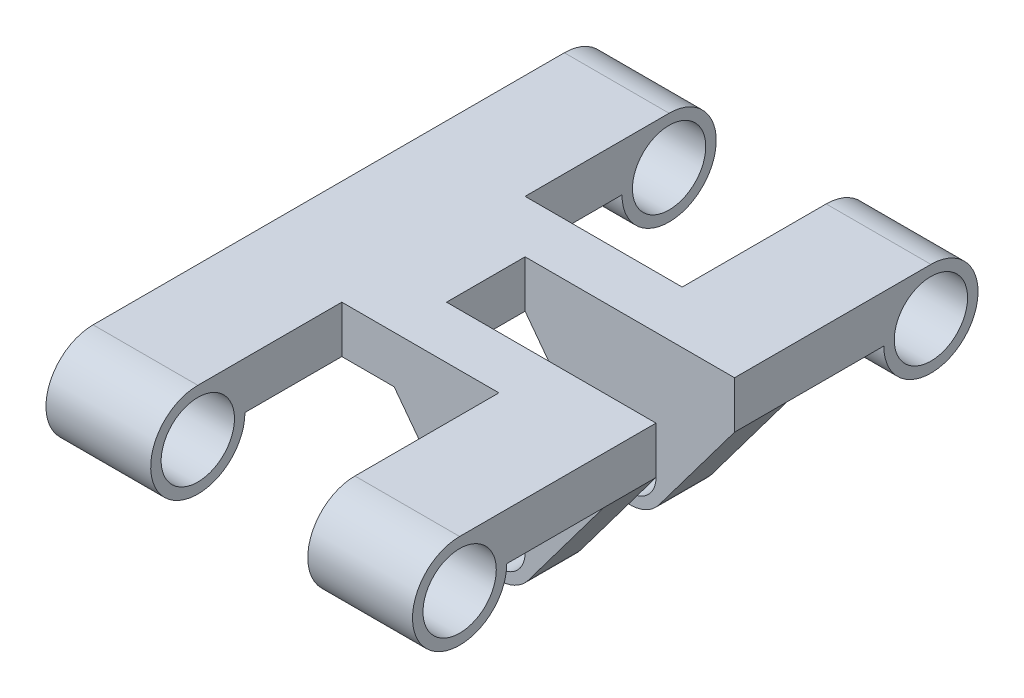
from build123d import *

# Parameters (mm, degrees)
SKETCH1_R           = 9
SKETCH1_R_2         = 7
BOSS_EXTRUDE1_DEPTH = 20
BOSS_EXTRUDE2_DEPTH = 9
SKETCH3_R           = 9
SKETCH3_R_2         = 7
BOSS_EXTRUDE4_DEPTH = 20
SKETCH6_R           = 5
BOSS_EXTRUDE7_DEPTH = 10
BOSS_EXTRUDE8_START = 25
SKETCH6_3_R         = 5
BOSS_EXTRUDE8_DEPTH = 10


with BuildPart() as part:
    # Sketch1 → Boss-Extrude1 (new body)
    # profile 1 of 3: a face of its own
    with BuildSketch(Plane(origin=(0, 0, 0), x_dir=(0, 0, -1), z_dir=(1, 0, 0))):
        with BuildLine():
            Line((90, 9), (0, 9))
            ThreePointArc((0, 9), (6.363961031, 6.363961031), (9, 0))
            Line((9, 0), (81, 0))
            ThreePointArc((81, 0), (83.636038969, 6.363961031), (90, 9))
        make_face()
    # profile 2 of 3: a face of its own
    with BuildSketch(Plane(origin=(0, 0, 0), x_dir=(0, 0, -1), z_dir=(1, 0, 0))):
        Circle(SKETCH1_R)
        Circle(SKETCH1_R_2, mode=Mode.SUBTRACT)
    # profile 3 of 3: a face of its own
    with BuildSketch(Plane(origin=(0, 0, 0), x_dir=(0, 0, -1), z_dir=(1, 0, 0))):
        with Locations((90, 0)):
            Circle(SKETCH1_R)
        with Locations((90, 0)):
            Circle(SKETCH1_R_2, mode=Mode.SUBTRACT)
    extrude(amount=-BOSS_EXTRUDE1_DEPTH)

    # Sketch2 → Boss-Extrude2 (add)
    with BuildSketch(Plane(origin=(0, 9, 0), x_dir=(1, 0, 0), z_dir=(0, 1, 0))):
        Polygon((0, 62.5), (50, 62.5), (50, 52.5), (10, 52.5), (10, 37.5), (50, 37.5), (50, 27.5), (0, 27.5), align=None)
    extrude(amount=-BOSS_EXTRUDE2_DEPTH)

    # Sketch3 → Boss-Extrude4 (add)
    # profile 1 of 4: a face of its own
    with BuildSketch(Plane(origin=(50, 0, 0), x_dir=(0, 0, -1), z_dir=(1, 0, 0))):
        Circle(SKETCH3_R)
        Circle(SKETCH3_R_2, mode=Mode.SUBTRACT)
    # profile 2 of 4: a face of its own
    with BuildSketch(Plane(origin=(50, 0, 0), x_dir=(0, 0, -1), z_dir=(1, 0, 0))):
        with BuildLine():
            Line((27.5, 9), (0, 9))
            ThreePointArc((0, 9), (6.363961031, 6.363961031), (9, 0))
            Line((9, 0), (27.5, 0))
            Line((27.5, 0), (27.5, 9))
        make_face()
    # profile 3 of 4: a face of its own
    with BuildSketch(Plane(origin=(50, 0, 0), x_dir=(0, 0, -1), z_dir=(1, 0, 0))):
        with BuildLine():
            Line((90, 9), (52.5, 9))
            Line((52.5, 9), (52.5, 0))
            Line((52.5, 0), (81, 0))
            ThreePointArc((81, 0), (83.636038969, 6.363961031), (90, 9))
        make_face()
    # profile 4 of 4: a face of its own
    with BuildSketch(Plane(origin=(50, 0, 0), x_dir=(0, 0, -1), z_dir=(1, 0, 0))):
        with Locations((90, 0)):
            Circle(SKETCH3_R)
        with Locations((90, 0)):
            Circle(SKETCH3_R_2, mode=Mode.SUBTRACT)
    extrude(amount=-BOSS_EXTRUDE4_DEPTH)

    # Sketch6 → Boss-Extrude7 (add)
    with BuildSketch(Plane.XY.offset(-52.5)):
        with BuildLine():
            Line((10, 0), (24.4, -19.2))
            ThreePointArc((24.4, -19.2), (30, -22), (35.6, -19.2))
            Line((35.6, -19.2), (50, 0))
            Line((50, 0), (10, 0))
        make_face()
        with Locations((30, -15)):
            Circle(SKETCH6_R, mode=Mode.SUBTRACT)
    extrude(amount=-BOSS_EXTRUDE7_DEPTH)

    # Sketch6<3> → Boss-Extrude8 (add)
    with BuildSketch(Plane.XY.offset(-52.5).offset(BOSS_EXTRUDE8_START)):
        with BuildLine():
            Line((10, 0), (24.4, -19.2))
            ThreePointArc((24.4, -19.2), (30, -22), (35.6, -19.2))
            Line((35.6, -19.2), (50, 0))
            Line((50, 0), (10, 0))
        make_face()
        with Locations((30, -15)):
            Circle(SKETCH6_3_R, mode=Mode.SUBTRACT)
    extrude(amount=-BOSS_EXTRUDE8_DEPTH)


solid = part.part
